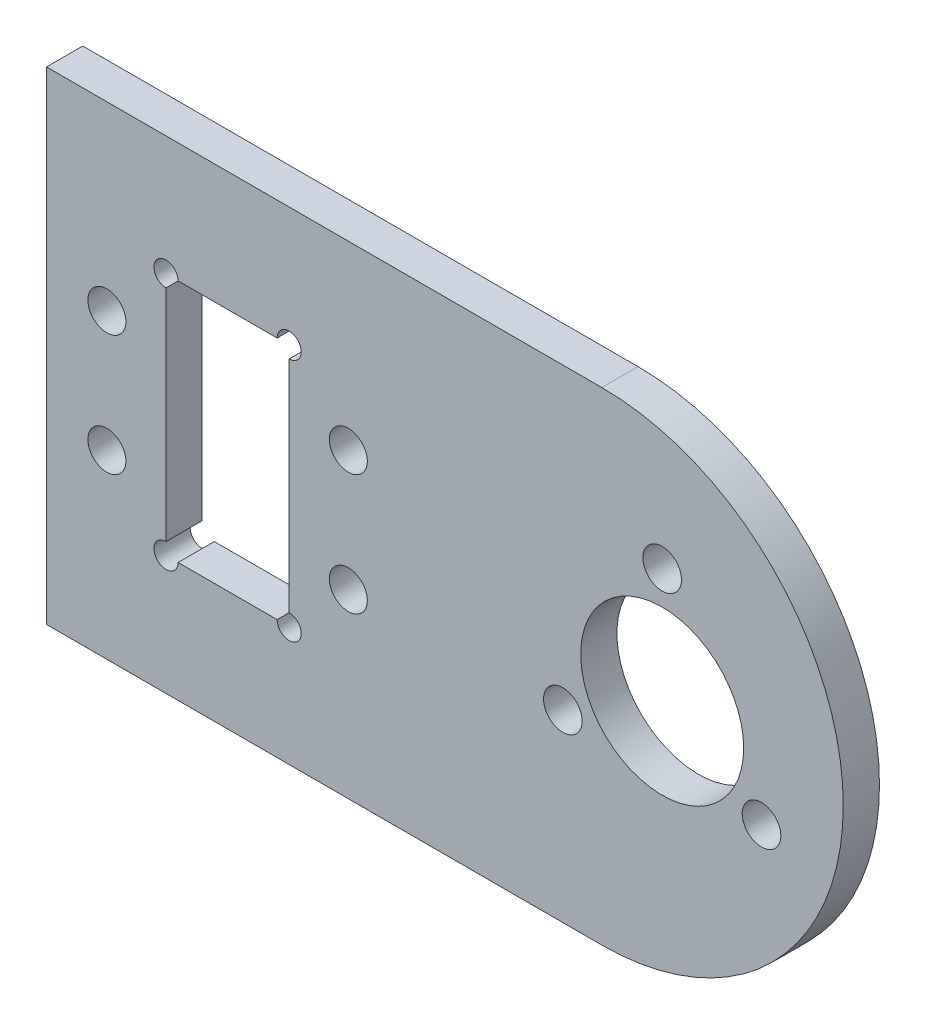
from build123d import *

# Parameters (mm, degrees)
EXTRUDE_1_DEPTH     = 3
SKETCH_2_R          = 1.575
SKETCH_2_R_2        = 6.75
SKETCH_2_R_3        = 1.6
SKETCH_2_W          = 10.2
SKETCH_2_H          = 20.2
CUT_EXTRUDE_1_DEPTH = 62.032778079
SKETCH_3_R          = 1
CUT_EXTRUDE_2_DEPTH = 62.032778079


with BuildPart() as part:
    # 草图1 → 凸台-拉伸1 (new body)
    with BuildSketch(Plane.XY):
        with BuildLine():
            Line((0, 0), (-46, 0))
            Line((-46, 0), (-46, -40))
            Line((-46, -40), (0, -40))
            ThreePointArc((0, -40), (20, -20), (0, 0))
        make_face()
    extrude(amount=EXTRUDE_1_DEPTH)

    # 草图2 → 切除-拉伸1 (cut, through all)
    with BuildSketch(Plane.XY.offset(3)):
        with Locations((-41, -15)):
            Circle(SKETCH_2_R)
        with Locations(Location((-41, -25, 0), (0, 0, 180))):
            Circle(SKETCH_2_R)
        with Locations((-21, -25)):
            Circle(SKETCH_2_R)
        with Locations(Location((-21, -15, 0), (0, 0, 180))):
            Circle(SKETCH_2_R)
        with Locations((5, -20)):
            Circle(SKETCH_2_R_2)
        with Locations((5, -10.5)):
            Circle(SKETCH_2_R_3)
        with Locations((13.227241336, -24.75)):
            Circle(SKETCH_2_R_3)
        with Locations((-3.227241336, -24.75)):
            Circle(SKETCH_2_R_3)
        with Locations((-31, -20)):
            Rectangle(SKETCH_2_W, SKETCH_2_H)
    extrude(amount=-CUT_EXTRUDE_1_DEPTH, mode=Mode.SUBTRACT)

    # 草图3 → 切除-拉伸2 (cut, through all)
    with BuildSketch(Plane.XY.offset(3)):
        with Locations((-25.9, -9.9)):
            Circle(SKETCH_3_R)
        with Locations((-25.9, -30.1)):
            Circle(SKETCH_3_R)
        with Locations((-36.1, -30.1)):
            Circle(SKETCH_3_R)
        with Locations((-36.1, -9.9)):
            Circle(SKETCH_3_R)
    extrude(amount=-CUT_EXTRUDE_2_DEPTH, mode=Mode.SUBTRACT)


solid = part.part
